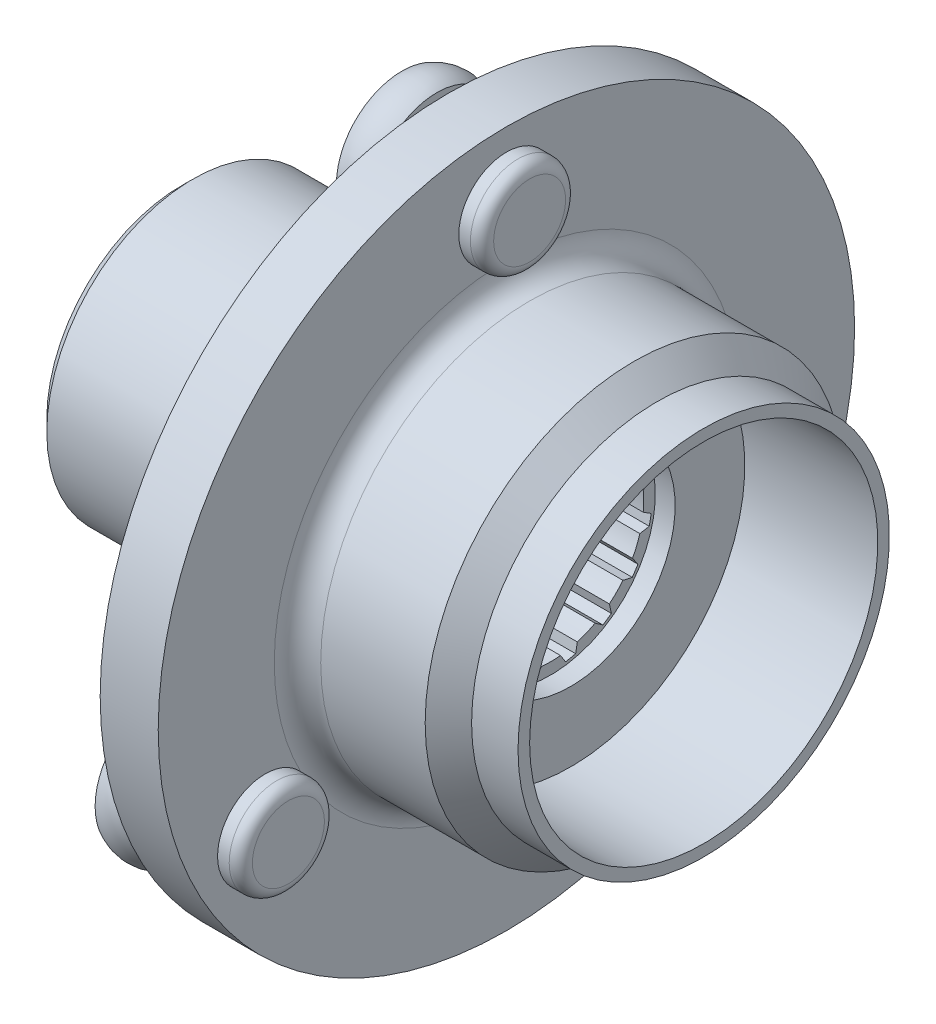
from build123d import *

# Parameters (mm, degrees)
R_P_TITION_CIRCULAIRE1_COUNT = 3
ENL_V_MAT_EXTRU_1_DEPTH      = 28.852674991
R_P_TITION_CIRCULAIRE2_COUNT = 16


with BuildPart() as part:
    # Esquisse1 → Base-Révolution (revolve)
    with BuildSketch(Plane.XY, mode=Mode.PRIVATE) as base_r_volution_sk:
        with BuildLine():
            Line((0, 6.5), (0, 15))
            Line((0, 15), (2.5, 15))
            Line((2.5, 15), (2.5, 10))
            ThreePointArc((2.5, 10), (2.792893219, 9.292893219), (3.5, 9))
            Line((3.5, 9), (8, 9))
            Line((8, 9), (9, 8))
            Line((9, 8), (11, 8))
            Line((11, 8), (11, 7.5))
            Line((11, 7.5), (5.270857301, 7.5))
            Line((5.270857301, 7.5), (5.270857301, 4.5))
            Line((5.270857301, 4.5), (4.414683801, 4.5))
            Line((4.414683801, 4.5), (4.414683801, 4))
            Line((4.414683801, 4), (-7.048528061, 4))
            Line((-7.048528061, 4), (-7.048528061, 4.5))
            Line((-7.048528061, 4.5), (-11.015640849, 4.5))
            Line((-11.015640849, 4.5), (-11.5, 4.984359151))
            Line((-11.5, 4.984359151), (-11.5, 5.8))
            Line((-11.5, 5.8), (-11, 6.3))
            Line((-11, 6.3), (-4, 6.3))
            Line((-4, 6.3), (-4, 6.5))
            Line((-4, 6.5), (0, 6.5))
        make_face()
    revolve(base_r_volution_sk.sketch.rotate(Axis((0, 0, 0), (1, 0, 0)), 90), axis=Axis((0, 0, 0), (1, 0, 0)))

    # Esquisse2 → Boss.-Révol.1 (revolve)
    with BuildSketch(Plane.XY, mode=Mode.PRIVATE) as boss_r_vol_1_sk:
        with BuildLine():
            Line((-2, 14.825926515), (-2, 12))
            Line((-2, 12), (3.5, 12))
            Line((3.5, 12), (3.5, 13.549844237))
            ThreePointArc((3.5, 13.549844237), (3.353553391, 13.903397627), (3, 14.049844237))
            Line((3, 14.049844237), (2.5, 14.049844237))
            Line((2.5, 14.049844237), (2.5, 13.5))
            Line((2.5, 13.5), (-0.5, 13.5))
            Line((-0.5, 13.5), (-0.5, 14.77158125))
            ThreePointArc((-0.5, 14.77158125), (-1.242717735, 14.999753862), (-2, 14.825926515))
        make_face()
    boss_r_vol_1 = revolve(boss_r_vol_1_sk.sketch.rotate(Axis((-4, 12, 0), (1, 0, 0)), 90), axis=Axis((-4, 12, 0), (1, 0, 0)))

    # Répétition circulaire1: Boss.-Révol.1 ×3 about axis
    r_p_tition_circulaire1_axis = Axis((0, 0, 0), (1, 0, 0))
    for i in range(1, R_P_TITION_CIRCULAIRE1_COUNT):
        add(boss_r_vol_1.rotate(r_p_tition_circulaire1_axis, i * 360 / R_P_TITION_CIRCULAIRE1_COUNT))

    # Esquisse3 → Enlèv. mat.-Extru.1 (cut, through all)
    with BuildSketch(Plane.ZY.offset(7.048528061)):
        Polygon((-0.28620955, 3.776566067), (-0.634766699, 4.324785757), (-1.068575897, 4.238495742), (-1.18080612, 3.598619746), align=None)
    enl_v_mat_extru_1 = extrude(amount=-ENL_V_MAT_EXTRU_1_DEPTH, mode=Mode.SUBTRACT)

    # Répétition circulaire2: Enlèv. mat.-Extru.1 ×16 about axis
    r_p_tition_circulaire2_axis = Axis((0, 0, 0), (1, 0, 0))
    for i in range(1, R_P_TITION_CIRCULAIRE2_COUNT):
        add(enl_v_mat_extru_1.rotate(r_p_tition_circulaire2_axis, i * 360 / R_P_TITION_CIRCULAIRE2_COUNT), mode=Mode.SUBTRACT)


solid = part.part
